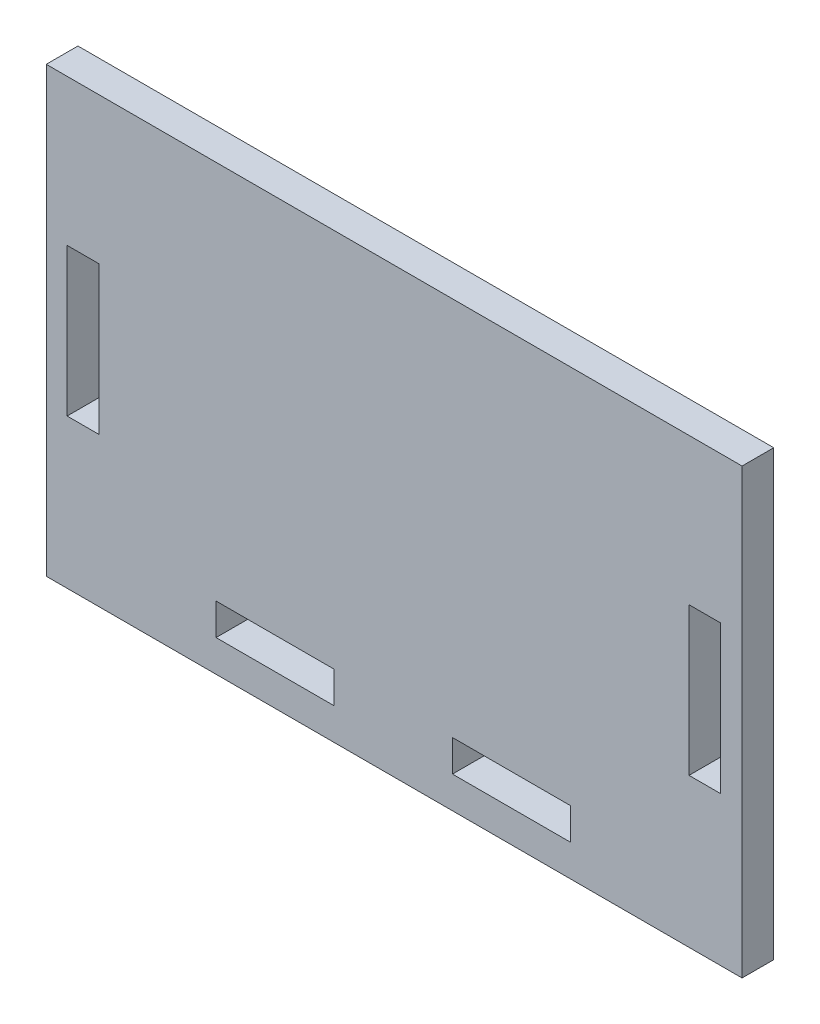
from build123d import *

# Parameters (mm, degrees)
ESQUISSE1_W        = 65.91
ESQUISSE1_H        = 42
ESQUISSE1_W_2      = 3
ESQUISSE1_H_2      = 14
ESQUISSE1_W_3      = 11.201657275
ESQUISSE1_H_3      = 3
ESQUISSE1_W_4      = 11.195023061
ESQUISSE1_W_5      = 3.00451359
BOSS_EXTRU_6_DEPTH = 3


with BuildPart() as part:
    # Esquisse1 → Boss.-Extru.6 (new body)
    with BuildSketch(Plane.XY):
        with Locations((33.208835649, 20.768243176)):
            Rectangle(ESQUISSE1_W, ESQUISSE1_H)
        with Locations((3.731125427, 20.90148268)):
            Rectangle(ESQUISSE1_W_2, ESQUISSE1_H_2, mode=Mode.SUBTRACT)
        with Locations((44.331730189, 4.279773399)):
            Rectangle(ESQUISSE1_W_3, ESQUISSE1_H_3, mode=Mode.SUBTRACT)
        with Locations((21.935047296, 4.279773399)):
            Rectangle(ESQUISSE1_W_4, ESQUISSE1_H_3, mode=Mode.SUBTRACT)
        with Locations((62.638868632, 20.877363246)):
            Rectangle(ESQUISSE1_W_5, ESQUISSE1_H_2, mode=Mode.SUBTRACT)
    extrude(amount=BOSS_EXTRU_6_DEPTH)


solid = part.part
